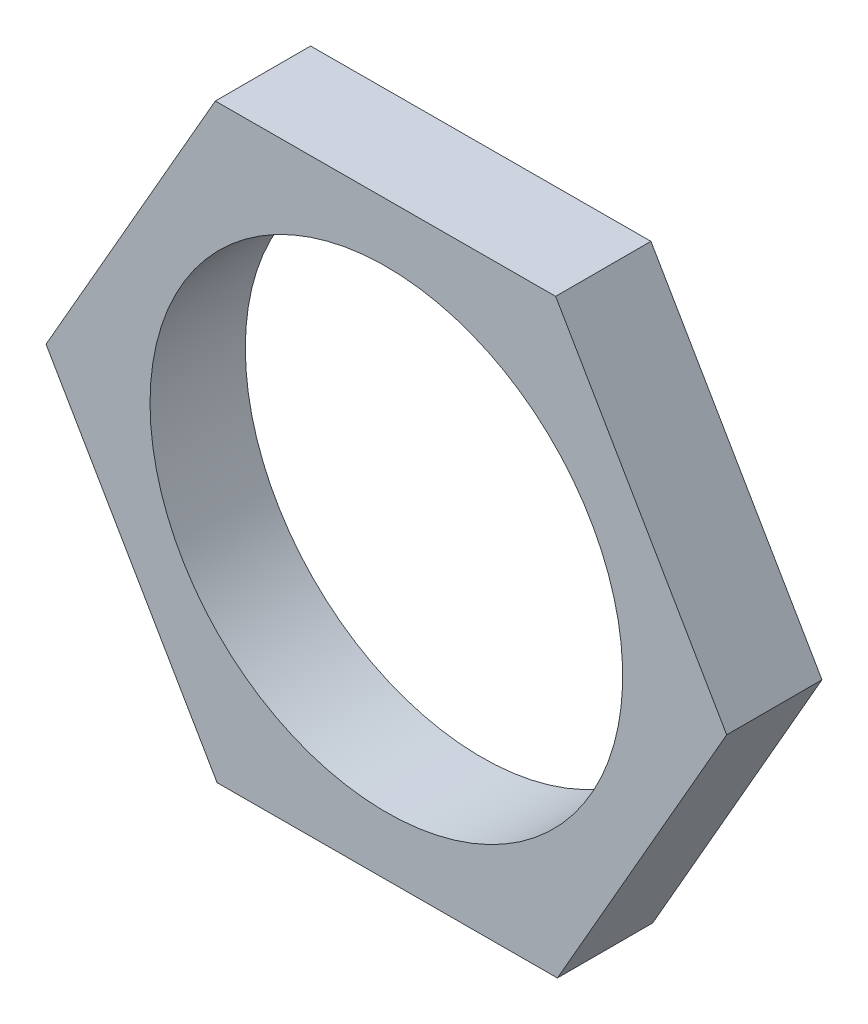
from build123d import *

# Parameters (mm, degrees)
RESSALTO_EXTRUS_O1_DEPTH = 2
ESBO_O2_R                = 4.9609375
CORTE_EXTRUS_O1_DEPTH    = 10.666377669


with BuildPart() as part:
    # Esboço1 → Ressalto-extrusão1 (new body)
    with BuildSketch(Plane.XY):
        Polygon((3.553451716, 6.197269154), (-3.590266663, 6.176014034), (-7.143718379, -0.021255119), (-3.553451716, -6.197269154), (3.590266663, -6.176014034), (7.143718379, 0.021255119), align=None)
    extrude(amount=RESSALTO_EXTRUS_O1_DEPTH)

    # Esboço2 → Corte-extrusão1 (cut, through all)
    with BuildSketch(Plane(origin=(0, 0, 0), x_dir=(-1, 0, 0), z_dir=(0, 0, -1))):
        Circle(ESBO_O2_R)
    extrude(amount=-CORTE_EXTRUS_O1_DEPTH, mode=Mode.SUBTRACT)


solid = part.part
